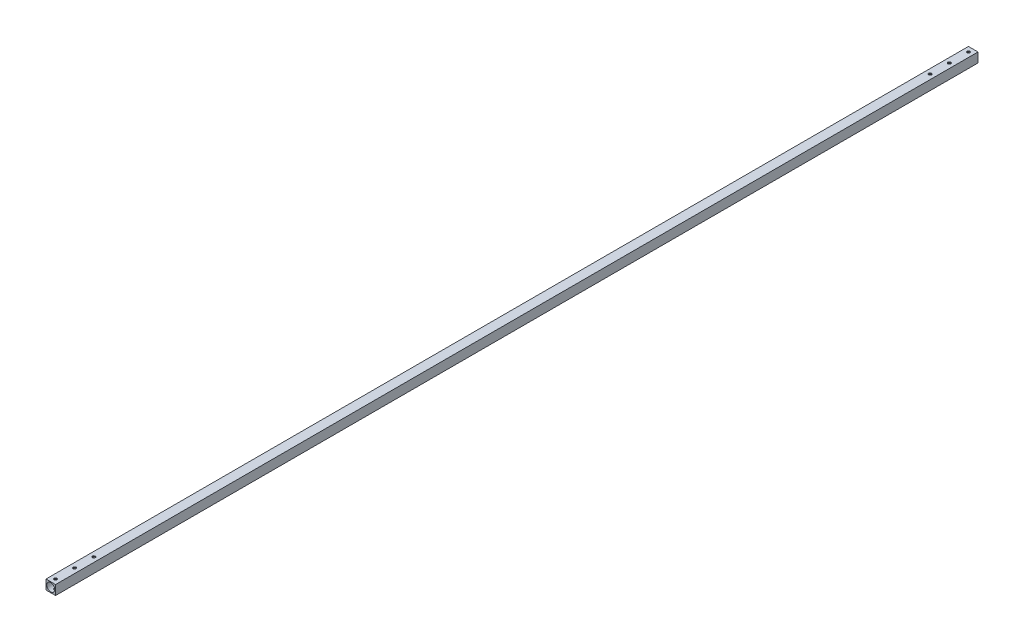
from build123d import *

# Parameters (mm, degrees)
SKETCH1_W           = 10
SKETCH1_H           = 10
SKETCH1_R           = 4.25
BOSS_EXTRUDE1_DEPTH = 964
SKETCH2_R           = 1.5
CUT_EXTRUDE1_DEPTH  = 965.064831845


with BuildPart() as part:
    # Sketch1 → Boss-Extrude1 (new body)
    with BuildSketch(Plane.XY):
        Rectangle(SKETCH1_W, SKETCH1_H)
        Circle(SKETCH1_R, mode=Mode.SUBTRACT)
    extrude(amount=BOSS_EXTRUDE1_DEPTH)

    # Sketch2 → Cut-Extrude1 (cut, through all)
    with BuildSketch(Plane(origin=(0, 5, 0), x_dir=(1, 0, 0), z_dir=(0, 1, 0))):
        with Locations(Location((0, -5, 0), (0, 0, 270))):
            Circle(SKETCH2_R)
        with Locations(Location((0, -25, 0), (0, 0, 270))):
            Circle(SKETCH2_R)
        with Locations(Location((0, -45, 0), (0, 0, 270))):
            Circle(SKETCH2_R)
        with Locations(Location((0, -959, 0), (0, 0, 270))):
            Circle(SKETCH2_R)
        with Locations(Location((0, -939, 0), (0, 0, 270))):
            Circle(SKETCH2_R)
        with Locations(Location((0, -919, 0), (0, 0, 270))):
            Circle(SKETCH2_R)
    extrude(amount=-CUT_EXTRUDE1_DEPTH, mode=Mode.SUBTRACT)


solid = part.part
